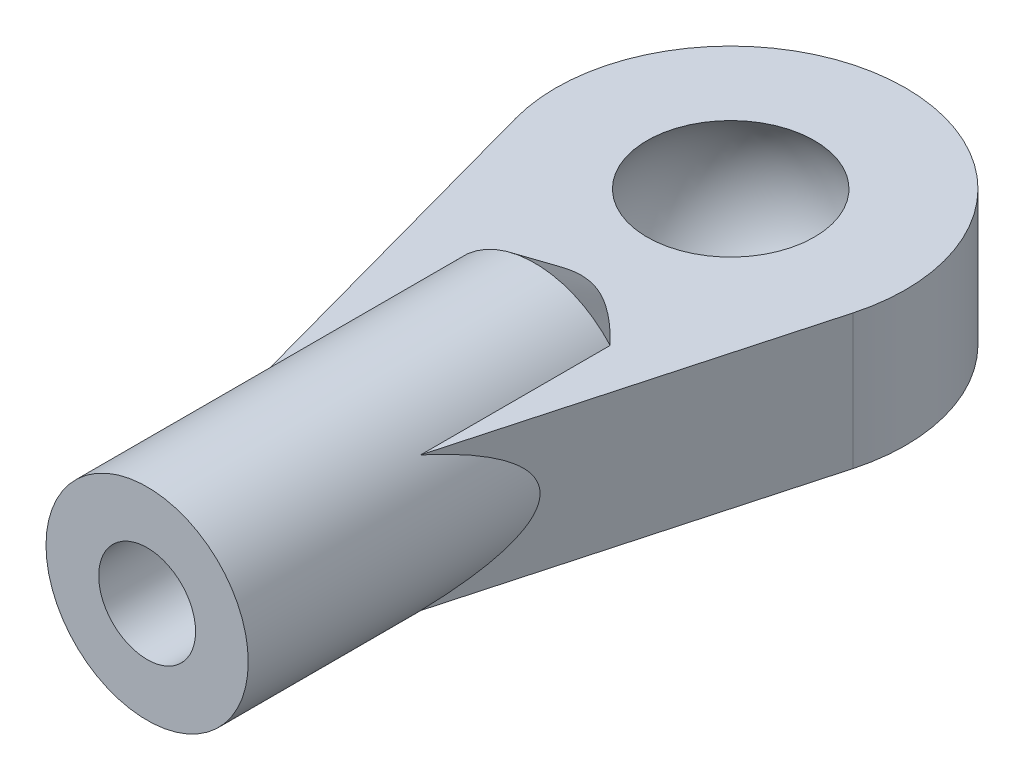
from build123d import *

# Parameters (mm, degrees)
BOSS_EXTRUDE1_START                = -3.2
BOSS_EXTRUDE1_DEPTH                = 3.2
SKETCH3_R                          = 2.4
BOSS_EXTRUDE2_DEPTH                = 9.2
SKETCH4_R                          = 2.4
BOSS_EXTRUDE3_DEPTH                = 1.2
BOSS_EXTRUDE3_TAPER                = 36
CUT_EXTRUDE1_DEPTH                 = 6.925
BOSS_EXTRUDE4_DEPTH                = 3.2
TAP_DRILL_FOR_M2_2_HELICOIL1_D     = 2.3
TAP_DRILL_FOR_M2_2_HELICOIL1_DEPTH = 9.2
TAP_DRILL_FOR_M2_2_HELICOIL1_TIP   = 0.690989712


with BuildPart() as part:
    # Sketch1 → Revolve1 (revolve)
    with BuildSketch(Plane.XY):
        with BuildLine():
            Line((1.985572965, 1.6), (4.15, 1.6))
            Line((4.15, 1.6), (4.15, -1.6))
            Line((4.15, -1.6), (1.985572965, -1.6))
            ThreePointArc((1.985572965, -1.6), (2.55, 0), (1.985572965, 1.6))
        make_face()
    revolve(axis=Axis((0, 0, 0), (0, 1, 0)))

    # Sketch2 → Boss-Extrude1 (add)
    with BuildSketch(Plane(origin=(0, 1.6, 0), x_dir=(1, 0, 0), z_dir=(0, 1, 0)).offset(BOSS_EXTRUDE1_START)):
        with BuildLine():
            Line((-2.4, -6.925), (-4.001507312, -1.100199632))
            ThreePointArc((-4.001507312, -1.100199632), (0, -4.15), (4.001507312, -1.100199632))
            Line((4.001507312, -1.100199632), (2.4, -6.925))
            Line((2.4, -6.925), (2.4, -13.85))
            Line((2.4, -13.85), (-2.4, -13.85))
            Line((-2.4, -13.85), (-2.4, -6.925))
        make_face()
    extrude(amount=BOSS_EXTRUDE1_DEPTH)

    # Sketch3 → Boss-Extrude2 (add)
    with BuildSketch(Plane.XY.offset(13.85)):
        Circle(SKETCH3_R)
    extrude(amount=-BOSS_EXTRUDE2_DEPTH)

    # Sketch4 → Boss-Extrude3 (add)
    with BuildSketch(Plane(origin=(0, 0, 4.65), x_dir=(-1, 0, 0), z_dir=(0, 0, -1))):
        Circle(SKETCH4_R)
    extrude(amount=BOSS_EXTRUDE3_DEPTH, taper=BOSS_EXTRUDE3_TAPER)

    # Sketch5 → Cut-Extrude1 (cut)
    with BuildSketch(Plane.XY.offset(13.85)):
        with BuildLine():
            Line((2.4, 1.6), (1.788854382, 1.6))
            ThreePointArc((1.788854382, 1.6), (2.242013662, 0.856373015), (2.4, 0))
            Line((2.4, 0), (2.4, 1.6))
        make_face()
        with BuildLine():
            Line((2.4, -1.6), (2.4, 0))
            ThreePointArc((2.4, 0), (2.242013662, -0.856373015), (1.788854382, -1.6))
            Line((1.788854382, -1.6), (2.4, -1.6))
        make_face()
        with BuildLine():
            Line((-2.4, 1.6), (-2.4, 0))
            ThreePointArc((-2.4, 0), (-2.242013662, 0.856373015), (-1.788854382, 1.6))
            Line((-1.788854382, 1.6), (-2.4, 1.6))
        make_face()
        with BuildLine():
            Line((-2.4, 0), (-2.4, -1.6))
            Line((-2.4, -1.6), (-1.788854382, -1.6))
            ThreePointArc((-1.788854382, -1.6), (-2.242013662, -0.856373015), (-2.4, 0))
        make_face()
    extrude(amount=-CUT_EXTRUDE1_DEPTH, mode=Mode.SUBTRACT)

    # Sketch6 → Boss-Extrude4 (add)
    with BuildSketch(Plane(origin=(0, 1.6, 0), x_dir=(1, 0, 0), z_dir=(0, 1, 0))):
        Polygon((-2.4, -6.925), (-1, -12.016903392), (1, -12.016903392), (2.4, -6.925), align=None)
    extrude(amount=-BOSS_EXTRUDE4_DEPTH)

    # Tap Drill for M2.2 Helicoil1
    with Locations(Plane.XY.offset(13.85)):
        with Locations((0, 0)):
            Hole(TAP_DRILL_FOR_M2_2_HELICOIL1_D / 2, depth=TAP_DRILL_FOR_M2_2_HELICOIL1_DEPTH)
            with Locations((0, 0, -(TAP_DRILL_FOR_M2_2_HELICOIL1_DEPTH + TAP_DRILL_FOR_M2_2_HELICOIL1_TIP / 2))):  # 118° drill point
                Cone(0, TAP_DRILL_FOR_M2_2_HELICOIL1_D / 2, TAP_DRILL_FOR_M2_2_HELICOIL1_TIP, mode=Mode.SUBTRACT)


solid = part.part
